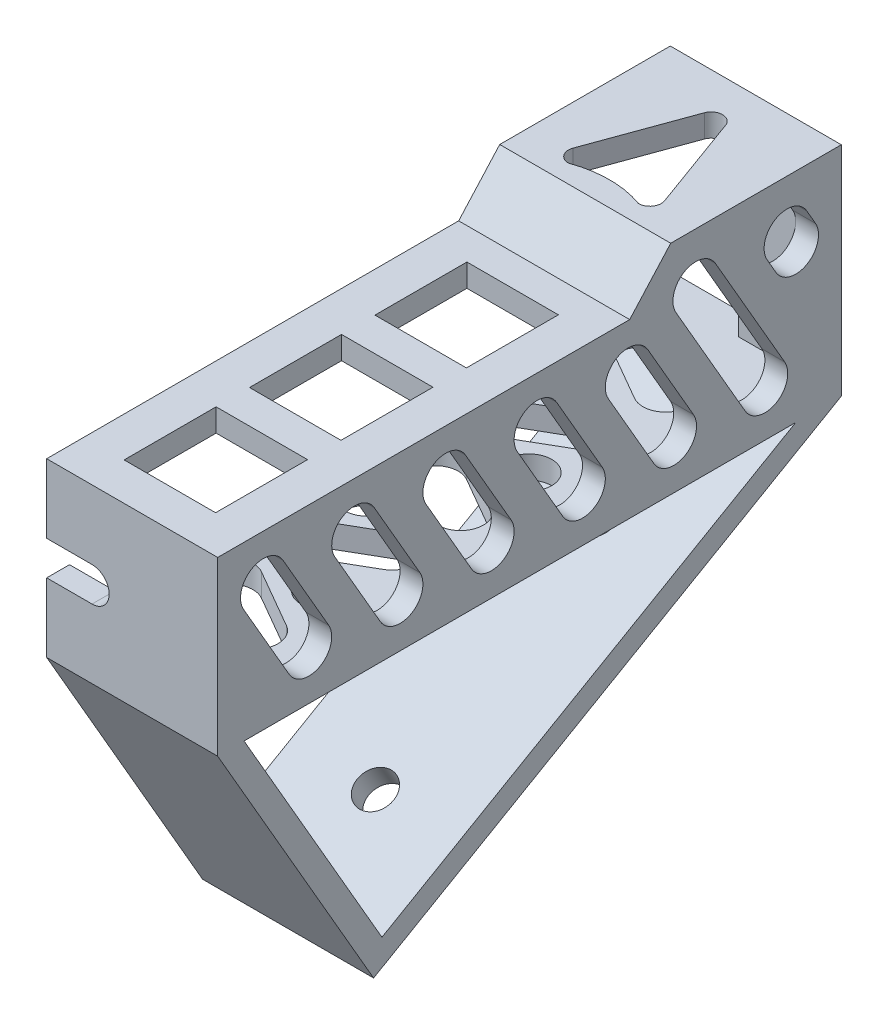
from build123d import *

# Parameters (mm, degrees)
EXTRUDE_1_DEPTH        = 15
EXTRUDE_3_DEPTH        = 15
EXTRUDE_4_DEPTH        = 2
CUT_EXTRUDE_1_REACH    = 64.285
CUT_EXTRUDE_4_REACH    = 64.285
SKETCH_4_W             = 8
SKETCH_4_H             = 15.1
CUT_EXTRUDE_5_REACH    = 50.798
SKETCH_6_R             = 1.6
CUT_EXTRUDE_2973_REACH = 42.44
CUT_EXTRUDE_3454_REACH = 54.949
SKETCH_10_W            = 8.022612094
SKETCH_10_H            = 8.068386681
CUT_EXTRUDE_4144_REACH = 42.408
SKETCH_11_R            = 2


with BuildPart() as part:
    # 草图1 → 凸台-拉伸1 (new body)
    with BuildSketch(Plane(origin=(0, 0, 0), x_dir=(0, 0, -1), z_dir=(1, 0, 0))):
        Polygon((27.35, 17.05), (12.38700707, 17.05), (8.78700707, 13.05), (-27.35, 13.05), (-27.35, -2.05), (27.35, -2.05), align=None)
        Polygon((9.67773188, 11.05), (13.27773188, 15.05), (25.35, 15.05), (25.35, -0.05), (-25.35, -0.05), (-25.35, 11.05), align=None, mode=Mode.SUBTRACT)
    extrude(amount=-EXTRUDE_1_DEPTH)

    # 草图3 → 凸台-拉伸3 (add)
    with BuildSketch(Plane(origin=(0, 0, 0), x_dir=(0, 0, -1), z_dir=(1, 0, 0))):
        Polygon((-13.675, -25.735794794), (27.35, -2.05), (23.35, -2.05), (-12.942949192, -23.003743986), (-25.040598923, -2.05), (-27.35, -2.05), align=None)
    extrude(amount=-EXTRUDE_3_DEPTH)

    # 草图1<4> → 凸台-拉伸4 (add)
    with BuildSketch(Plane(origin=(0, 0, 0), x_dir=(0, 0, -1), z_dir=(1, 0, 0))):
        Polygon((25.35, 15.05), (13.27773188, 15.05), (9.67773188, 11.05), (-25.35, 11.05), (-25.35, -0.05), (25.35, -0.05), align=None)
    extrude(amount=-EXTRUDE_4_DEPTH)

    # 草图2 → 切除-拉伸1 (cut, up to next)
    with BuildSketch(Plane.XY.offset(27.35), mode=Mode.PRIVATE) as cut_extrude_1_sk1:
        with BuildLine():
            Line((-15, 4), (-11.02, 4))
            ThreePointArc((-11.02, 4), (-9.52, 5.5), (-11.02, 7))
            Line((-11.02, 7), (-15, 7))
            Line((-15, 7), (-15, 4))
        make_face()
    cut_extrude_1_tool1 = extrude(cut_extrude_1_sk1.sketch, amount=-CUT_EXTRUDE_1_REACH, mode=Mode.PRIVATE) & part.part
    add(cut_extrude_1_tool1.solids().sort_by_distance((-12.410086, 5.5, 27.35))[0], mode=Mode.SUBTRACT)

    # 草图4 → 切除-拉伸4 (cut, up to next)
    with BuildSketch(Plane(origin=(0, 0, -27.35), x_dir=(-1, 0, 0), z_dir=(0, 0, -1)), mode=Mode.PRIVATE) as cut_extrude_4_sk1:
        with Locations((11, 7.5)):
            Rectangle(SKETCH_4_W, SKETCH_4_H)
    cut_extrude_4_tool1 = extrude(cut_extrude_4_sk1.sketch, amount=-CUT_EXTRUDE_4_REACH, mode=Mode.PRIVATE) & part.part
    add(cut_extrude_4_tool1.solids().sort_by_distance((-11, 7.5, -27.35))[0], mode=Mode.SUBTRACT)

    # 草图6 → 切除-拉伸5 (cut, up to next)
    with BuildSketch(Plane(origin=(0, -13.380397397, -7.725176039), x_dir=(1, 0, 0), z_dir=(0, -0.8660254037844414, -0.49999999999999517)), mode=Mode.PRIVATE) as cut_extrude_5_sk1:
        with Locations((-7.5, 14.710794794)):
            Circle(SKETCH_6_R)
    cut_extrude_5_tool1 = extrude(cut_extrude_5_sk1.sketch, amount=-CUT_EXTRUDE_5_REACH, mode=Mode.PRIVATE) & part.part
    # 草图6 → 切除-拉伸5 (cut, up to next)
    with BuildSketch(Plane(origin=(0, -13.380397397, -7.725176039), x_dir=(1, 0, 0), z_dir=(0, -0.8660254037844414, -0.49999999999999517)), mode=Mode.PRIVATE) as cut_extrude_5_sk2:
        with Locations((-7.5, -7.660794794)):
            Circle(SKETCH_6_R)
    cut_extrude_5_tool2 = extrude(cut_extrude_5_sk2.sketch, amount=-CUT_EXTRUDE_5_REACH, mode=Mode.PRIVATE) & part.part
    add(cut_extrude_5_tool1.solids().sort_by_distance((-7.5, -20.735795, 5.014746))[0], mode=Mode.SUBTRACT)
    add(cut_extrude_5_tool2.solids().sort_by_distance((-7.5, -9.55, -14.359619))[0], mode=Mode.SUBTRACT)

    # 草图9 → Cut-Extrude 2973 (cut, up to next)
    with BuildSketch(Plane(origin=(0, 0, 0), x_dir=(0, 0, -1), z_dir=(1, 0, 0)), mode=Mode.PRIVATE) as cut_extrude_2973_sk1:
        with BuildLine():
            Line((-21.617949192, 9.964101615), (-17.617949192, 3.035898385))
            ThreePointArc((-17.617949192, 3.035898385), (-18.35, 0.303847577), (-21.082050808, 1.035898385))
            Line((-21.082050808, 1.035898385), (-25.082050808, 7.964101615))
            ThreePointArc((-25.082050808, 7.964101615), (-24.35, 10.696152423), (-21.617949192, 9.964101615))
        make_face()
    cut_extrude_2973_tool1 = extrude(cut_extrude_2973_sk1.sketch, amount=-CUT_EXTRUDE_2973_REACH, mode=Mode.PRIVATE) & part.part
    # 草图9 → Cut-Extrude 2973 (cut, up to next)
    with BuildSketch(Plane(origin=(0, 0, 0), x_dir=(0, 0, -1), z_dir=(1, 0, 0)), mode=Mode.PRIVATE) as cut_extrude_2973_sk2:
        with BuildLine():
            Line((-13.617949192, 9.964101615), (-9.617949192, 3.035898385))
            ThreePointArc((-9.617949192, 3.035898385), (-10.35, 0.303847577), (-13.082050808, 1.035898385))
            Line((-13.082050808, 1.035898385), (-17.082050808, 7.964101615))
            ThreePointArc((-17.082050808, 7.964101615), (-16.35, 10.696152423), (-13.617949192, 9.964101615))
        make_face()
    cut_extrude_2973_tool2 = extrude(cut_extrude_2973_sk2.sketch, amount=-CUT_EXTRUDE_2973_REACH, mode=Mode.PRIVATE) & part.part
    # 草图9 → Cut-Extrude 2973 (cut, up to next)
    with BuildSketch(Plane(origin=(0, 0, 0), x_dir=(0, 0, -1), z_dir=(1, 0, 0)), mode=Mode.PRIVATE) as cut_extrude_2973_sk3:
        with BuildLine():
            Line((-5.617949192, 9.964101615), (-1.617949192, 3.035898385))
            ThreePointArc((-1.617949192, 3.035898385), (-2.35, 0.303847577), (-5.082050808, 1.035898385))
            Line((-5.082050808, 1.035898385), (-9.082050808, 7.964101615))
            ThreePointArc((-9.082050808, 7.964101615), (-8.35, 10.696152423), (-5.617949192, 9.964101615))
        make_face()
    cut_extrude_2973_tool3 = extrude(cut_extrude_2973_sk3.sketch, amount=-CUT_EXTRUDE_2973_REACH, mode=Mode.PRIVATE) & part.part
    # 草图9 → Cut-Extrude 2973 (cut, up to next)
    with BuildSketch(Plane(origin=(0, 0, 0), x_dir=(0, 0, -1), z_dir=(1, 0, 0)), mode=Mode.PRIVATE) as cut_extrude_2973_sk4:
        with BuildLine():
            Line((2.382050808, 9.964101615), (6.382050808, 3.035898385))
            ThreePointArc((6.382050808, 3.035898385), (5.65, 0.303847577), (2.917949192, 1.035898385))
            Line((2.917949192, 1.035898385), (-1.082050808, 7.964101615))
            ThreePointArc((-1.082050808, 7.964101615), (-0.35, 10.696152423), (2.382050808, 9.964101615))
        make_face()
    cut_extrude_2973_tool4 = extrude(cut_extrude_2973_sk4.sketch, amount=-CUT_EXTRUDE_2973_REACH, mode=Mode.PRIVATE) & part.part
    # 草图9 → Cut-Extrude 2973 (cut, up to next)
    with BuildSketch(Plane(origin=(0, 0, 0), x_dir=(0, 0, -1), z_dir=(1, 0, 0)), mode=Mode.PRIVATE) as cut_extrude_2973_sk5:
        with BuildLine():
            Line((10.382050808, 9.964101615), (14.382050808, 3.035898385))
            ThreePointArc((14.382050808, 3.035898385), (13.65, 0.303847577), (10.917949192, 1.035898385))
            Line((10.917949192, 1.035898385), (6.917949192, 7.964101615))
            ThreePointArc((6.917949192, 7.964101615), (7.65, 10.696152423), (10.382050808, 9.964101615))
        make_face()
    cut_extrude_2973_tool5 = extrude(cut_extrude_2973_sk5.sketch, amount=-CUT_EXTRUDE_2973_REACH, mode=Mode.PRIVATE) & part.part
    # 草图9 → Cut-Extrude 2973 (cut, up to next)
    with BuildSketch(Plane(origin=(0, 0, 0), x_dir=(0, 0, -1), z_dir=(1, 0, 0)), mode=Mode.PRIVATE) as cut_extrude_2973_sk6:
        with BuildLine():
            Line((16.31173141, 13.55), (22.382050808, 3.035898385))
            ThreePointArc((22.382050808, 3.035898385), (21.65, 0.303847577), (18.917949192, 1.035898385))
            Line((18.917949192, 1.035898385), (12.847629795, 11.55))
            ThreePointArc((12.847629795, 11.55), (13.579680602, 14.282050808), (16.31173141, 13.55))
        make_face()
    cut_extrude_2973_tool6 = extrude(cut_extrude_2973_sk6.sketch, amount=-CUT_EXTRUDE_2973_REACH, mode=Mode.PRIVATE) & part.part
    # 草图9 → Cut-Extrude 2973 (cut, up to next)
    with BuildSketch(Plane(origin=(0, 0, 0), x_dir=(0, 0, -1), z_dir=(1, 0, 0)), mode=Mode.PRIVATE) as cut_extrude_2973_sk7:
        with BuildLine():
            Line((24.31173141, 13.55), (25.082050808, 12.215767665))
            ThreePointArc((25.082050808, 12.215767665), (24.35, 9.483716857), (21.617949192, 10.215767665))
            Line((21.617949192, 10.215767665), (20.847629795, 11.55))
            ThreePointArc((20.847629795, 11.55), (21.579680602, 14.282050808), (24.31173141, 13.55))
        make_face()
    cut_extrude_2973_tool7 = extrude(cut_extrude_2973_sk7.sketch, amount=-CUT_EXTRUDE_2973_REACH, mode=Mode.PRIVATE) & part.part
    add(cut_extrude_2973_tool1.solids().sort_by_distance((0, 5.5, 21.35))[0], mode=Mode.SUBTRACT)
    add(cut_extrude_2973_tool2.solids().sort_by_distance((0, 5.5, 13.35))[0], mode=Mode.SUBTRACT)
    add(cut_extrude_2973_tool3.solids().sort_by_distance((0, 5.5, 5.35))[0], mode=Mode.SUBTRACT)
    add(cut_extrude_2973_tool4.solids().sort_by_distance((0, 5.5, -2.65))[0], mode=Mode.SUBTRACT)
    add(cut_extrude_2973_tool5.solids().sort_by_distance((0, 5.5, -10.65))[0], mode=Mode.SUBTRACT)
    add(cut_extrude_2973_tool6.solids().sort_by_distance((0, 7.292949, -17.61484))[0], mode=Mode.SUBTRACT)
    add(cut_extrude_2973_tool7.solids().sort_by_distance((0, 11.882884, -22.96484))[0], mode=Mode.SUBTRACT)

    # 草图10 → Cut-Extrude 3454 (cut, up to next)
    with BuildSketch(Plane(origin=(0, 17.05, 0), x_dir=(1, 0, 0), z_dir=(0, 1, 0)), mode=Mode.PRIVATE) as cut_extrude_3454_sk1:
        with BuildLine():
            Line((-11.511306047, 15.329027214), (-8.439692621, 23.768215743))
            ThreePointArc((-8.439692621, 23.768215743), (-7.5, 24.4261956), (-6.560307379, 23.768215743))
            Line((-6.560307379, 23.768215743), (-3.488693953, 15.329027214))
            ThreePointArc((-3.488693953, 15.329027214), (-3.60923453, 14.413430634), (-4.428386574, 13.98700707))
            ThreePointArc((-4.428386574, 13.98700707), (-7.5, 14.527385864), (-10.571613426, 13.98700707))
            ThreePointArc((-10.571613426, 13.98700707), (-11.39076547, 14.413430634), (-11.511306047, 15.329027214))
        make_face()
    cut_extrude_3454_tool1 = extrude(cut_extrude_3454_sk1.sketch, amount=-CUT_EXTRUDE_3454_REACH, mode=Mode.PRIVATE) & part.part
    # 草图10 → Cut-Extrude 3454 (cut, up to next)
    with BuildSketch(Plane(origin=(0, 17.05, 0), x_dir=(1, 0, 0), z_dir=(0, 1, 0)), mode=Mode.PRIVATE) as cut_extrude_3454_sk2:
        with Locations((-7.5, -9.01299293)):
            Rectangle(SKETCH_10_W, SKETCH_10_H)
    cut_extrude_3454_tool2 = extrude(cut_extrude_3454_sk2.sketch, amount=-CUT_EXTRUDE_3454_REACH, mode=Mode.PRIVATE) & part.part
    # 草图10 → Cut-Extrude 3454 (cut, up to next)
    with BuildSketch(Plane(origin=(0, 17.05, 0), x_dir=(1, 0, 0), z_dir=(0, 1, 0)), mode=Mode.PRIVATE) as cut_extrude_3454_sk3:
        with Locations((-7.5, 1.987007071)):
            Rectangle(SKETCH_10_W, SKETCH_10_H)
    cut_extrude_3454_tool3 = extrude(cut_extrude_3454_sk3.sketch, amount=-CUT_EXTRUDE_3454_REACH, mode=Mode.PRIVATE) & part.part
    # 草图10 → Cut-Extrude 3454 (cut, up to next)
    with BuildSketch(Plane(origin=(0, 17.05, 0), x_dir=(1, 0, 0), z_dir=(0, 1, 0)), mode=Mode.PRIVATE) as cut_extrude_3454_sk4:
        with Locations((-7.5, -20.01299293)):
            Rectangle(SKETCH_10_W, SKETCH_10_H)
    cut_extrude_3454_tool4 = extrude(cut_extrude_3454_sk4.sketch, amount=-CUT_EXTRUDE_3454_REACH, mode=Mode.PRIVATE) & part.part
    add(cut_extrude_3454_tool1.solids().sort_by_distance((-7.5, 17.05, -18.142881))[0], mode=Mode.SUBTRACT)
    add(cut_extrude_3454_tool2.solids().sort_by_distance((-7.5, 17.05, 9.012993))[0], mode=Mode.SUBTRACT)
    add(cut_extrude_3454_tool3.solids().sort_by_distance((-7.5, 17.05, -1.987007))[0], mode=Mode.SUBTRACT)
    add(cut_extrude_3454_tool4.solids().sort_by_distance((-7.5, 17.05, 20.012993))[0], mode=Mode.SUBTRACT)

    # 草图11 → Cut-Extrude 4144 (cut, up to next)
    with BuildSketch(Plane(origin=(0, -0.05, 0), x_dir=(1, 0, 0), z_dir=(0, 1, 0)), mode=Mode.PRIVATE) as cut_extrude_4144_sk1:
        with Locations((-11.098076211, 14.85)):
            Circle(SKETCH_11_R)
    cut_extrude_4144_tool1 = extrude(cut_extrude_4144_sk1.sketch, amount=-CUT_EXTRUDE_4144_REACH, mode=Mode.PRIVATE) & part.part
    # 草图11 → Cut-Extrude 4144 (cut, up to next)
    with BuildSketch(Plane(origin=(0, -0.05, 0), x_dir=(1, 0, 0), z_dir=(0, 1, 0)), mode=Mode.PRIVATE) as cut_extrude_4144_sk2:
        with Locations((-5.901923789, 5.85)):
            Circle(SKETCH_11_R)
    cut_extrude_4144_tool2 = extrude(cut_extrude_4144_sk2.sketch, amount=-CUT_EXTRUDE_4144_REACH, mode=Mode.PRIVATE) & part.part
    # 草图11 → Cut-Extrude 4144 (cut, up to next)
    with BuildSketch(Plane(origin=(0, -0.05, 0), x_dir=(1, 0, 0), z_dir=(0, 1, 0)), mode=Mode.PRIVATE) as cut_extrude_4144_sk3:
        with Locations((-11.098076211, -3.15)):
            Circle(SKETCH_11_R)
    cut_extrude_4144_tool3 = extrude(cut_extrude_4144_sk3.sketch, amount=-CUT_EXTRUDE_4144_REACH, mode=Mode.PRIVATE) & part.part
    # 草图11 → Cut-Extrude 4144 (cut, up to next)
    with BuildSketch(Plane(origin=(0, -0.05, 0), x_dir=(1, 0, 0), z_dir=(0, 1, 0)), mode=Mode.PRIVATE) as cut_extrude_4144_sk4:
        with Locations((-5.901923789, -12.15)):
            Circle(SKETCH_11_R)
    cut_extrude_4144_tool4 = extrude(cut_extrude_4144_sk4.sketch, amount=-CUT_EXTRUDE_4144_REACH, mode=Mode.PRIVATE) & part.part
    # 草图11 → Cut-Extrude 4144 (cut, up to next)
    with BuildSketch(Plane(origin=(0, -0.05, 0), x_dir=(1, 0, 0), z_dir=(0, 1, 0)), mode=Mode.PRIVATE) as cut_extrude_4144_sk5:
        with Locations((-11.098076211, -21.15)):
            Circle(SKETCH_11_R)
    cut_extrude_4144_tool5 = extrude(cut_extrude_4144_sk5.sketch, amount=-CUT_EXTRUDE_4144_REACH, mode=Mode.PRIVATE) & part.part
    # 草图11 → Cut-Extrude 4144 (cut, up to next)
    with BuildSketch(Plane(origin=(0, -0.05, 0), x_dir=(1, 0, 0), z_dir=(0, 1, 0)), mode=Mode.PRIVATE) as cut_extrude_4144_sk6:
        with BuildLine():
            Line((-10.098076211, 22.582050808), (-4.901923789, 19.582050808))
            ThreePointArc((-4.901923789, 19.582050808), (-4.169872981, 16.85), (-6.901923789, 16.117949192))
            Line((-6.901923789, 16.117949192), (-12.098076211, 19.117949192))
            ThreePointArc((-12.098076211, 19.117949192), (-12.830127019, 21.85), (-10.098076211, 22.582050808))
        make_face()
    cut_extrude_4144_tool6 = extrude(cut_extrude_4144_sk6.sketch, amount=-CUT_EXTRUDE_4144_REACH, mode=Mode.PRIVATE) & part.part
    # 草图11 → Cut-Extrude 4144 (cut, up to next)
    with BuildSketch(Plane(origin=(0, -0.05, 0), x_dir=(1, 0, 0), z_dir=(0, 1, 0)), mode=Mode.PRIVATE) as cut_extrude_4144_sk7:
        with BuildLine():
            Line((-12.098076211, 10.582050808), (-6.901923789, 13.582050808))
            ThreePointArc((-6.901923789, 13.582050808), (-4.169872981, 12.85), (-4.901923789, 10.117949192))
            Line((-4.901923789, 10.117949192), (-10.098076211, 7.117949192))
            ThreePointArc((-10.098076211, 7.117949192), (-12.830127019, 7.85), (-12.098076211, 10.582050808))
        make_face()
    cut_extrude_4144_tool7 = extrude(cut_extrude_4144_sk7.sketch, amount=-CUT_EXTRUDE_4144_REACH, mode=Mode.PRIVATE) & part.part
    # 草图11 → Cut-Extrude 4144 (cut, up to next)
    with BuildSketch(Plane(origin=(0, -0.05, 0), x_dir=(1, 0, 0), z_dir=(0, 1, 0)), mode=Mode.PRIVATE) as cut_extrude_4144_sk8:
        with BuildLine():
            Line((-10.098076211, 4.582050808), (-4.901923789, 1.582050808))
            ThreePointArc((-4.901923789, 1.582050808), (-4.169872981, -1.15), (-6.901923789, -1.882050808))
            Line((-6.901923789, -1.882050808), (-12.098076211, 1.117949192))
            ThreePointArc((-12.098076211, 1.117949192), (-12.830127019, 3.85), (-10.098076211, 4.582050808))
        make_face()
    cut_extrude_4144_tool8 = extrude(cut_extrude_4144_sk8.sketch, amount=-CUT_EXTRUDE_4144_REACH, mode=Mode.PRIVATE) & part.part
    # 草图11 → Cut-Extrude 4144 (cut, up to next)
    with BuildSketch(Plane(origin=(0, -0.05, 0), x_dir=(1, 0, 0), z_dir=(0, 1, 0)), mode=Mode.PRIVATE) as cut_extrude_4144_sk9:
        with BuildLine():
            Line((-12.098076211, -7.417949192), (-6.901923789, -4.417949192))
            ThreePointArc((-6.901923789, -4.417949192), (-4.169872981, -5.15), (-4.901923789, -7.882050808))
            Line((-4.901923789, -7.882050808), (-10.098076211, -10.882050808))
            ThreePointArc((-10.098076211, -10.882050808), (-12.830127019, -10.15), (-12.098076211, -7.417949192))
        make_face()
    cut_extrude_4144_tool9 = extrude(cut_extrude_4144_sk9.sketch, amount=-CUT_EXTRUDE_4144_REACH, mode=Mode.PRIVATE) & part.part
    # 草图11 → Cut-Extrude 4144 (cut, up to next)
    with BuildSketch(Plane(origin=(0, -0.05, 0), x_dir=(1, 0, 0), z_dir=(0, 1, 0)), mode=Mode.PRIVATE) as cut_extrude_4144_sk10:
        with BuildLine():
            Line((-10.098076211, -13.417949192), (-4.901923789, -16.417949192))
            ThreePointArc((-4.901923789, -16.417949192), (-4.169872981, -19.15), (-6.901923789, -19.882050808))
            Line((-6.901923789, -19.882050808), (-12.098076211, -16.882050808))
            ThreePointArc((-12.098076211, -16.882050808), (-12.830127019, -14.15), (-10.098076211, -13.417949192))
        make_face()
    cut_extrude_4144_tool10 = extrude(cut_extrude_4144_sk10.sketch, amount=-CUT_EXTRUDE_4144_REACH, mode=Mode.PRIVATE) & part.part
    add(cut_extrude_4144_tool1.solids().sort_by_distance((-11.098076, -0.05, -14.85))[0], mode=Mode.SUBTRACT)
    add(cut_extrude_4144_tool2.solids().sort_by_distance((-5.901924, -0.05, -5.85))[0], mode=Mode.SUBTRACT)
    add(cut_extrude_4144_tool3.solids().sort_by_distance((-11.098076, -0.05, 3.15))[0], mode=Mode.SUBTRACT)
    add(cut_extrude_4144_tool4.solids().sort_by_distance((-5.901924, -0.05, 12.15))[0], mode=Mode.SUBTRACT)
    add(cut_extrude_4144_tool5.solids().sort_by_distance((-11.098076, -0.05, 21.15))[0], mode=Mode.SUBTRACT)
    add(cut_extrude_4144_tool6.solids().sort_by_distance((-8.5, -0.05, -19.35))[0], mode=Mode.SUBTRACT)
    add(cut_extrude_4144_tool7.solids().sort_by_distance((-8.5, -0.05, -10.35))[0], mode=Mode.SUBTRACT)
    add(cut_extrude_4144_tool8.solids().sort_by_distance((-8.5, -0.05, -1.35))[0], mode=Mode.SUBTRACT)
    add(cut_extrude_4144_tool9.solids().sort_by_distance((-8.5, -0.05, 7.65))[0], mode=Mode.SUBTRACT)
    add(cut_extrude_4144_tool10.solids().sort_by_distance((-8.5, -0.05, 16.65))[0], mode=Mode.SUBTRACT)


solid = part.part
